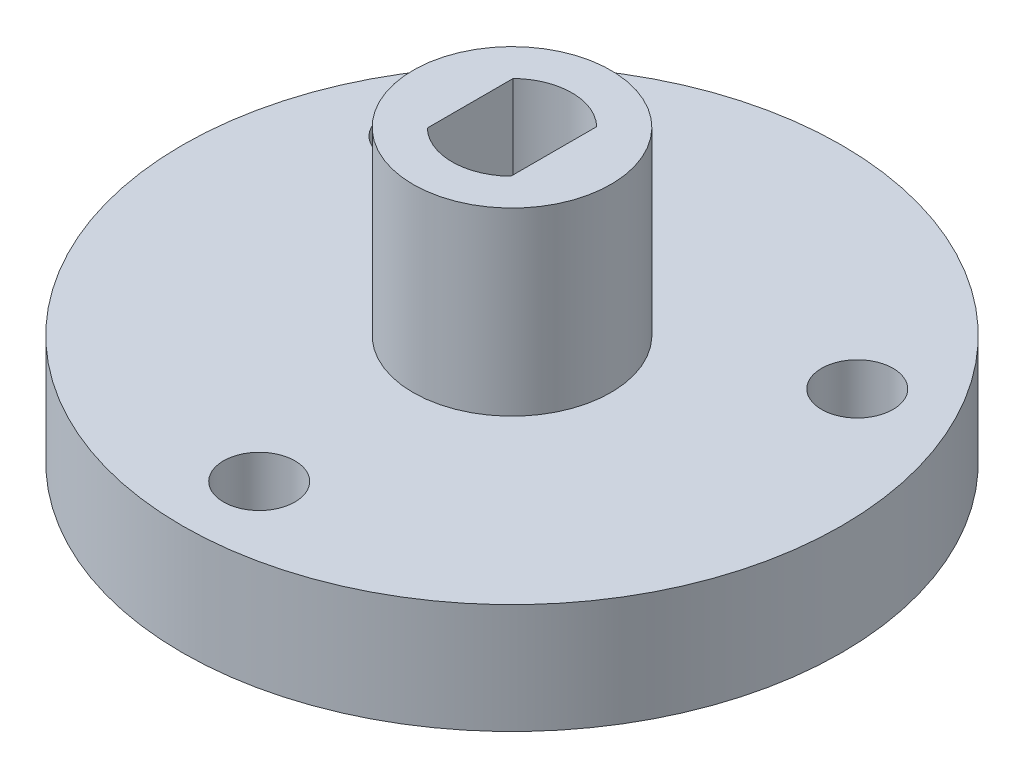
from build123d import *

# Parameters (mm, degrees)
SKETCH1_R           = 4.5
BOSS_EXTRUDE1_DEPTH = 8.2
SKETCH2_R           = 15
BOSS_EXTRUDE2_DEPTH = 5
SKETCH3_R           = 1
CUT_EXTRUDE1_DEPTH  = 25.984795376
SKETCH4_R           = 1.625
CUT_EXTRUDE2_DEPTH  = 25.984795376
CHAMFER1_SIZE       = 1.5
CHAMFER1_SIZE2      = 0.866025404


with BuildPart() as part:
    # Sketch1 → Boss-Extrude1 (new body)
    with BuildSketch(Plane(origin=(0, 0, 0), x_dir=(1, 0, 0), z_dir=(0, 1, 0))):
        Circle(SKETCH1_R)
        with BuildLine():
            Line((-1.9, 1.953362486), (-1.9, -1.953362486))
            ThreePointArc((-1.9, -1.953362486), (0, -2.725), (1.9, -1.953362486))
            Line((1.9, -1.953362486), (1.9, 1.953362486))
            ThreePointArc((1.9, 1.953362486), (0, 2.725), (-1.9, 1.953362486))
        make_face(mode=Mode.SUBTRACT)
    extrude(amount=BOSS_EXTRUDE1_DEPTH)

    # Sketch2 → Boss-Extrude2 (add)
    with BuildSketch(Plane.XZ):
        Circle(SKETCH2_R)
    extrude(amount=BOSS_EXTRUDE2_DEPTH)

    # Sketch3 → Cut-Extrude1 (cut, through all)
    with BuildSketch(Plane.XZ.offset(5)):
        Circle(SKETCH3_R)
    extrude(amount=-CUT_EXTRUDE1_DEPTH, mode=Mode.SUBTRACT)

    # Sketch4 → Cut-Extrude2 (cut, through all)
    with BuildSketch(Plane.XZ.offset(5)):
        with Locations((0, 11.5)):
            Circle(SKETCH4_R)
        with Locations((9.959292144, -5.75)):
            Circle(SKETCH4_R)
        with Locations((-9.959292144, -5.75)):
            Circle(SKETCH4_R)
    extrude(amount=-CUT_EXTRUDE2_DEPTH, mode=Mode.SUBTRACT)

    # Chamfer1
    chamfer1_edges = [part.edges().sort_by_distance(p)[0] for p in [
        (-1, -5, 0),
    ]]
    chamfer1_side = [part.faces().sort_by_distance(p)[0] for p in [
        (-14.575735931, -5, 0),
    ]]
    chamfer(chamfer1_edges, length=CHAMFER1_SIZE, length2=CHAMFER1_SIZE2, reference=chamfer1_side[0])


solid = part.part
